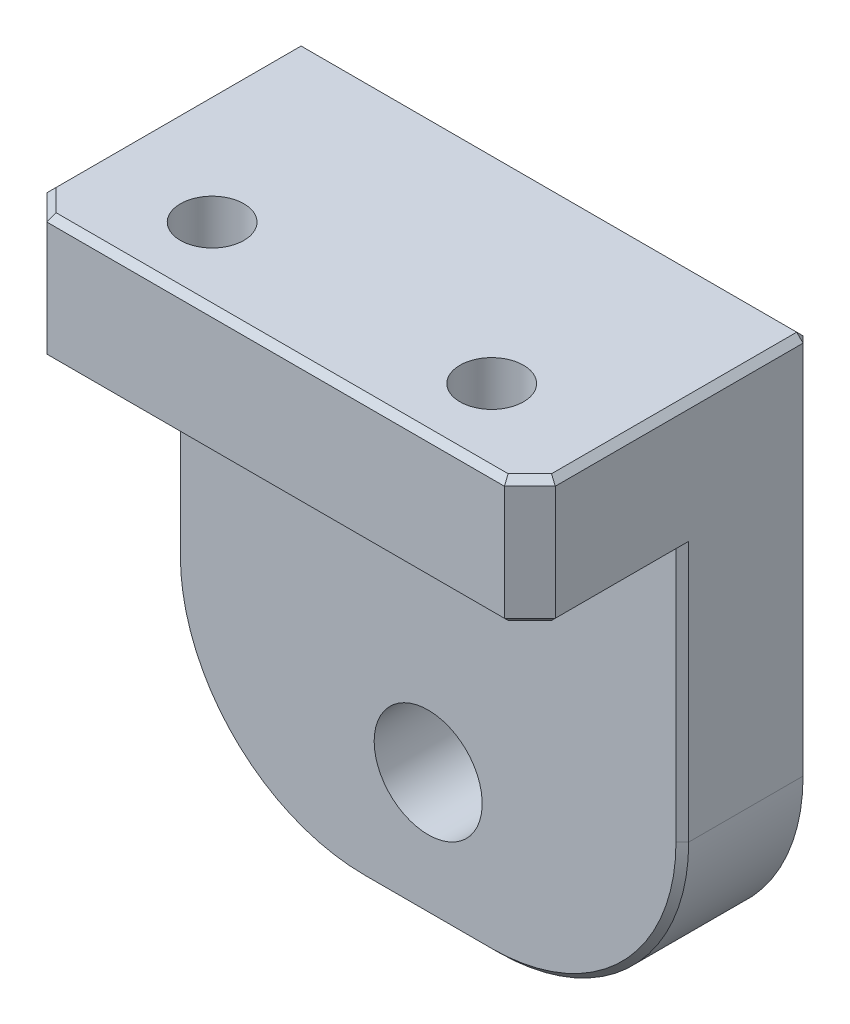
from build123d import *

# Parameters (mm, degrees)
SKETCH_1_W          = 40
SKETCH_1_H          = 45
EXTRUDE_1_DEPTH     = 5
SKETCH_2_W          = 40
SKETCH_2_H          = 10
EXTRUDE_2_DEPTH     = 12
HOLE_WIZARD_M10_1_D = 8.5
HOLE_WIZARD_M6_1_D  = 5
FILLET_1_R          = 15
CHAMFER_1_SIZE      = 2
CHAMFER_2_SIZE      = 0.5


with BuildPart() as part:
    # 草图1 → 凸台-拉伸1 (new, symmetric)
    with BuildSketch(Plane.XY):
        Rectangle(SKETCH_1_W, SKETCH_1_H)
    extrude(amount=EXTRUDE_1_DEPTH, both=True)

    # 草图2 → 凸台-拉伸2 (add)
    with BuildSketch(Plane.XY.offset(5)):
        with Locations((0, 17.5)):
            Rectangle(SKETCH_2_W, SKETCH_2_H)
    extrude(amount=EXTRUDE_2_DEPTH)

    # M10 螺纹孔1 (through all)
    with Locations(Plane(origin=(0, 0, -5), x_dir=(-1, 0, 0), z_dir=(0, 0, -1))):
        with Locations((0, -12.5)):
            Hole(HOLE_WIZARD_M10_1_D / 2)

    # M6 螺纹孔1 (through all)
    with Locations(Plane(origin=(0, 12.5, 0), x_dir=(-1, 0, 0), z_dir=(0, -1, 0))):
        with Locations((-11, -11), (11, -11)):
            Hole(HOLE_WIZARD_M6_1_D / 2)

    # 圆角1
    fillet_1_edges = [part.edges().sort_by_distance(p)[0] for p in [
        (20, -22.5, 0),
        (-20, -22.5, 0),
    ]]
    fillet(fillet_1_edges, radius=FILLET_1_R)

    # 倒角1
    chamfer_1_edges = [part.edges().sort_by_distance(p)[0] for p in [
        (-20, 17.5, 17),
        (20, 17.5, 17),
    ]]
    chamfer(chamfer_1_edges, length=CHAMFER_1_SIZE)

    # 倒角2
    chamfer_2_edges = [part.edges().sort_by_distance(p)[0] for p in [
        (-20, 2.5, 5),
        (0, -22.5, -5),
        (0, -22.5, 5),
        (20, 7.5, -5),
        (15.606601718, -18.106601718, -5),
        (-15.606601718, -18.106601718, -5),
        (20, 2.5, 5),
        (15.606601718, -18.106601718, 5),
        (-15.606601718, -18.106601718, 5),
        (-20, 7.5, -5),
        (0, 22.5, -5),
        (0, 12.5, 17),
        (0, 22.5, 17),
        (20, 12.5, 10),
        (-20, 12.5, 10),
        (19, 12.5, 16),
        (-19, 12.5, 16),
        (-20, 22.5, 5),
        (20, 22.5, 5),
        (19, 22.5, 16),
        (-19, 22.5, 16),
    ]]
    chamfer(chamfer_2_edges, length=CHAMFER_2_SIZE)


solid = part.part
